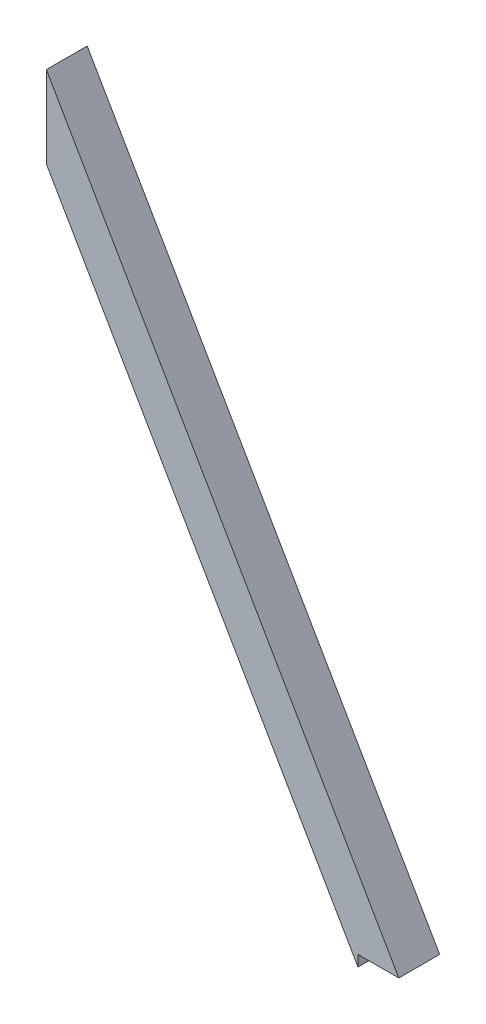
from build123d import *

# Parameters (mm, degrees)
BOSS_EXTRUDE1_DEPTH = 12.7


with BuildPart() as part:
    # Sketch1 → Boss-Extrude1 (new, symmetric)
    with BuildSketch(Plane.XY):
        Polygon((219.1893, 0), (0, 379.647004075), (0, 328.847004075), (193.7893, -6.805909488), (193.7893, 0), align=None)
    extrude(amount=BOSS_EXTRUDE1_DEPTH, both=True)


solid = part.part
